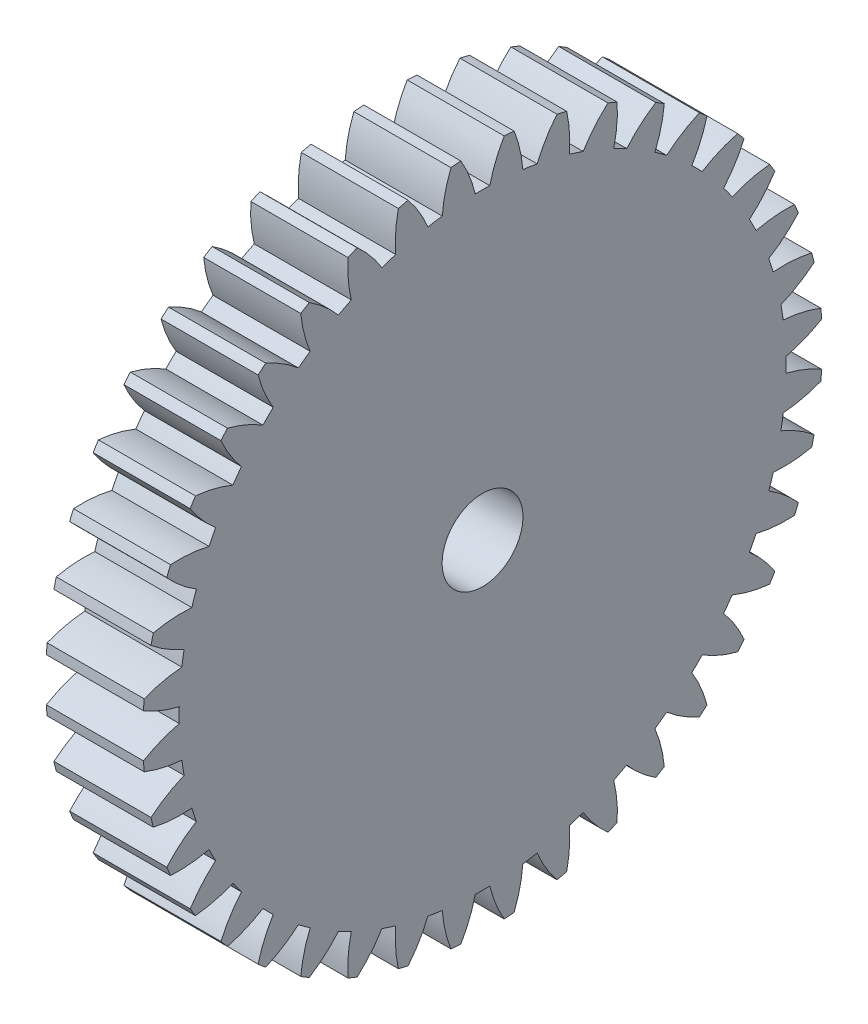
from build123d import *

# Parameters (mm, degrees)
BASPROSKE_W     = 6
BASPROSKE_H     = 21
TOOTHCUT_DEPTH  = 31.298514815
TEETHCUTS_COUNT = 40
TEETHCUTS_ANGLE = 351
BORSKE_R        = 2.5
BORE_DEPTH      = 50.0000508


with BuildPart() as part:
    # BasProSke → Base-Revolve (revolve)
    with BuildSketch(Plane(origin=(0, 0, 0), x_dir=(1, 0, 0), z_dir=(0, 1, 0)), mode=Mode.PRIVATE) as base_revolve_sk:
        with Locations((3, 10.5)):
            Rectangle(BASPROSKE_W, BASPROSKE_H)
    revolve(base_revolve_sk.sketch.rotate(Axis((-10, 0, 0), (1, 0, 0)), 180), axis=Axis((-10, 0, 0), (1, 0, 0)))

    # TooCutSke → ToothCut (cut, through all)
    with BuildSketch(Plane(origin=(0, 0, 0), x_dir=(0, 0, -1), z_dir=(1, 0, 0))):
        with BuildLine():
            ThreePointArc((0.448673268, 18.74363074), (0, 18.749), (-0.448673268, 18.74363074))
            ThreePointArc((-0.448673268, 18.74363074), (-0.816786816, 19.89705013), (-1.354745081, 20.981708961))
            ThreePointArc((-1.354745081, 20.981708961), (0, 21.0254), (1.354745081, 20.981708961))
            ThreePointArc((1.354745081, 20.981708961), (0.816786816, 19.89705013), (0.448673268, 18.74363074))
        make_face()
    toothcut = extrude(amount=TOOTHCUT_DEPTH, mode=Mode.SUBTRACT)

    # TeethCuts: ToothCut ×40 about axis
    teethcuts_axis = Axis((-10, 0, 0), (1, 0, 0))
    for i in range(1, TEETHCUTS_COUNT):
        add(toothcut.rotate(teethcuts_axis, i * TEETHCUTS_ANGLE / (TEETHCUTS_COUNT - 1)), mode=Mode.SUBTRACT)

    # BorSke → Bore (cut, symmetric)
    with BuildSketch(Plane(origin=(0, 0, 0), x_dir=(0, 0, -1), z_dir=(1, 0, 0))):
        with Locations(Location((0, 0, 0), (0, 0, 180))):
            Circle(BORSKE_R)
    extrude(amount=BORE_DEPTH, both=True, mode=Mode.SUBTRACT)


solid = part.part
